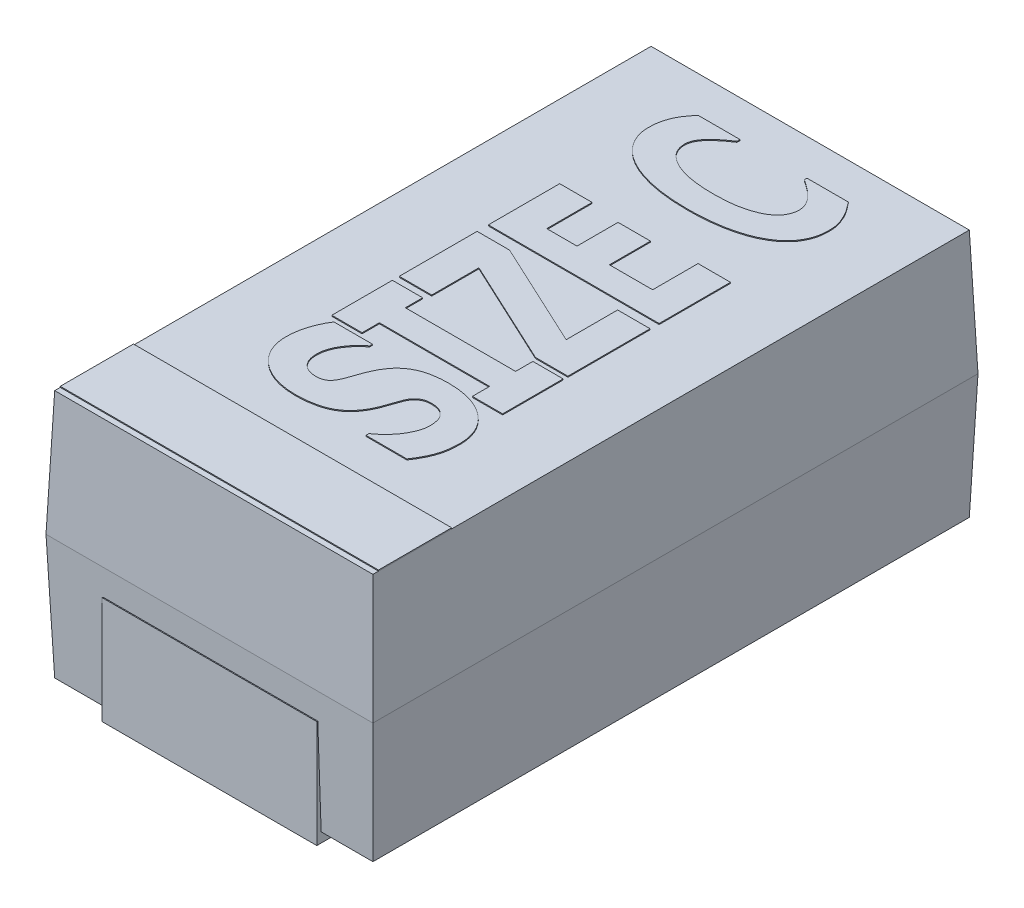
from build123d import *

# Parameters (mm, degrees)
SKETCH1_W                     = 3.35
SKETCH1_H                     = 6.2
BOSS_EXTRUDE1_DEPTH           = 1.275
BOSS_EXTRUDE1_TAPER           = 2
BOSS_EXTRUDE1_OTHER_WAY_DEPTH = 1.275
BOSS_EXTRUDE1_OTHER_WAY_TAPER = 2
BOSS_EXTRUDE2_DEPTH           = 0.1
BOSS_EXTRUDE2_DEPTH_BACK      = 1
SKETCH2_W                     = 2.2
SKETCH2_H                     = 1.35
SKETCH3_W                     = 3.260952038
SKETCH3_H                     = 0.75
EXTRUDE_THIN1_DEPTH           = 0.01
BOSS_EXTRUDE3_DEPTH           = 0.01


with BuildPart() as part:
    # Sketch1 → Boss-Extrude1 (new body)
    with BuildSketch(Plane(origin=(0, 0, 0), x_dir=(1, 0, 0), z_dir=(0, 1, 0))):
        Rectangle(SKETCH1_W, SKETCH1_H)
    extrude(amount=BOSS_EXTRUDE1_DEPTH, taper=BOSS_EXTRUDE1_TAPER)

    # Sketch1 → Boss-Extrude1 other way (add)
    with BuildSketch(Plane(origin=(0, 0, 0), x_dir=(1, 0, 0), z_dir=(0, 1, 0))):
        Rectangle(SKETCH1_W, SKETCH1_H)
    extrude(amount=-BOSS_EXTRUDE1_OTHER_WAY_DEPTH, taper=BOSS_EXTRUDE1_OTHER_WAY_TAPER)

    # Sketch2 → Boss-Extrude2 (add, two sides: drawn at the far end of the back side and taken through both)
    with BuildSketch(Plane.XZ.offset(1.275).offset(-BOSS_EXTRUDE2_DEPTH_BACK)):
        with Locations((0, 2.425)):
            Rectangle(SKETCH2_W, SKETCH2_H)
        with Locations((0, -2.425)):
            Rectangle(SKETCH2_W, SKETCH2_H)
    extrude(amount=BOSS_EXTRUDE2_DEPTH + BOSS_EXTRUDE2_DEPTH_BACK)

    # Sketch3 → Extrude-Thin1 (add)
    with BuildSketch(Plane(origin=(0, 1.275, 0), x_dir=(1, 0, 0), z_dir=(0, 1, 0))):
        with Locations((0, -2.623518775)):
            Rectangle(SKETCH3_W, SKETCH3_H)
    extrude(amount=EXTRUDE_THIN1_DEPTH)

    # Sketch4 → Boss-Extrude3 (add)
    with BuildSketch(Plane(origin=(0, 1.275, 0), x_dir=(1, 0, 0), z_dir=(0, 1, 0))):
        with BuildLine():
            add(Edge.make_bspline(
                [(0.334985513, -0.981015049), (0.356341192, -0.981437983), (0.398097454, -0.982264935), (0.459237763, -0.988016523), (0.517165286, -0.998514239), (0.572033428, -1.01266484), (0.624066299, -1.030586602), (0.672788399, -1.05312449), (0.718570647, -1.079641578), (0.76097127, -1.109898193), (0.799383719, -1.143643089), (0.832989635, -1.18065605), (0.861477479, -1.220598346), (0.885038197, -1.263473432), (0.902553009, -1.309592662), (0.915303843, -1.358322053), (0.923673634, -1.409921281), (0.924405226, -1.445363778), (0.924779816, -1.463511093)],
                knots=[0, 0, 0, 0, 1.195998746, 2.338508519, 3.434845331, 4.489568701, 5.509272365, 6.51248567, 7.491071706, 8.468291537, 9.425046025, 10.34910268, 11.26172539, 12.166745172, 13.081104647, 14.016767885, 14.984542854, 16, 16, 16, 16], degree=3))
            add(Edge.make_bspline(
                [(0.924779816, -1.463511093), (0.924305503, -1.484296469), (0.923385708, -1.524603758), (0.916550602, -1.583175424), (0.904514763, -1.637548314), (0.88761019, -1.688066754), (0.866722568, -1.735229484), (0.843896733, -1.780840346), (0.818284075, -1.824850775), (0.799295361, -1.853001712), (0.789791683, -1.867090998)],
                knots=[0, 0, 0, 0, 1.151801495, 2.233589449, 3.262100035, 4.232650712, 5.180547787, 6.118472198, 7.058312609, 8, 8, 8, 8], degree=3))
            Line((0.789791683, -1.867090998), (0.370982348, -1.867090998))
            Line((0.370982348, -1.867090998), (0.370982348, -1.837324384))
            add(Edge.make_bspline(
                [(0.370982348, -1.837324384), (0.389754163, -1.823278803), (0.426379187, -1.795874966), (0.474768814, -1.749479872), (0.516948622, -1.701148781), (0.551629713, -1.650483364), (0.579486508, -1.599249741), (0.599326457, -1.548321422), (0.612498894, -1.49844335), (0.61394651, -1.465202193), (0.614653234, -1.44897391)],
                knots=[0, 0, 0, 0, 1.184220586, 2.310490913, 3.381523037, 4.421764376, 5.408141254, 6.32227693, 7.180938069, 8, 8, 8, 8], degree=3))
            add(Edge.make_bspline(
                [(0.614653234, -1.44897391), (0.614125261, -1.439376479), (0.612922434, -1.41751163), (0.606976523, -1.383467124), (0.598646019, -1.34807723), (0.586408894, -1.327625202), (0.580733139, -1.318139258)],
                knots=[0, 0, 0, 0, 0.842610706, 1.919634185, 3.035096411, 4, 4, 4, 4], degree=3))
            add(Edge.make_bspline(
                [(0.580733139, -1.318139258), (0.572215816, -1.308311389), (0.55500165, -1.288448508), (0.527353645, -1.268878698), (0.500994402, -1.257381773), (0.476812346, -1.250716645), (0.448239825, -1.247755748), (0.427865605, -1.247156774), (0.417016763, -1.246837834)],
                knots=[0, 0, 0, 0, 1.254849191, 2.536147055, 3.230490899, 4.028879942, 4.950420152, 6, 6, 6, 6], degree=3))
            add(Edge.make_bspline(
                [(0.417016763, -1.246837834), (0.407524542, -1.247110937), (0.389171507, -1.247638977), (0.36266994, -1.253432387), (0.338173194, -1.262726788), (0.315985414, -1.276059585), (0.295778396, -1.29261467), (0.278217003, -1.312768519), (0.263003991, -1.336482193), (0.255255016, -1.3540143), (0.251223645, -1.363135302)],
                knots=[0, 0, 0, 0, 1.050957811, 2.032007846, 2.991808834, 3.943991893, 4.88910184, 5.877133343, 6.89558797, 8, 8, 8, 8], degree=3))
            add(Edge.make_bspline(
                [(0.251223645, -1.363135302), (0.243437054, -1.383614039), (0.227517982, -1.425481205), (0.206697569, -1.489911404), (0.18482008, -1.554753228), (0.163939585, -1.595144709), (0.153616842, -1.61511315)],
                knots=[0, 0, 0, 0, 0.971496617, 1.986148334, 3.00440698, 4, 4, 4, 4], degree=3))
            add(Edge.make_bspline(
                [(0.153616842, -1.61511315), (0.147429375, -1.626053844), (0.135316658, -1.647471584), (0.114650781, -1.677615611), (0.092166315, -1.705037447), (0.068489054, -1.730742964), (0.043021628, -1.753819961), (0.015684951, -1.774363031), (-0.013021806, -1.792854459), (-0.04362911, -1.808616592), (-0.075692735, -1.822737039), (-0.109870841, -1.834213564), (-0.145642031, -1.844920871), (-0.183611064, -1.852442053), (-0.223136397, -1.859347851), (-0.264659468, -1.863574757), (-0.30807076, -1.866468475), (-0.33764248, -1.866880395), (-0.352761718, -1.867090998)],
                knots=[0, 0, 0, 0, 1.00858435, 1.974426459, 2.929014615, 3.852922288, 4.777386756, 5.683106967, 6.595102396, 7.514683481, 8.443728771, 9.404362227, 10.406762678, 11.438424746, 12.508726001, 13.62653202, 14.786508553, 16, 16, 16, 16], degree=3))
            add(Edge.make_bspline(
                [(-0.352761718, -1.867090998), (-0.372970252, -1.866717333), (-0.412563805, -1.865985231), (-0.470392313, -1.859523672), (-0.525419875, -1.849673085), (-0.577550011, -1.835445531), (-0.626947712, -1.817112534), (-0.673439062, -1.794456151), (-0.717310955, -1.768205153), (-0.757752912, -1.737752318), (-0.794157754, -1.704018618), (-0.826446902, -1.668002951), (-0.853171655, -1.629103034), (-0.875591279, -1.588294829), (-0.892506402, -1.544813095), (-0.905160649, -1.499298448), (-0.912459433, -1.451286428), (-0.91336678, -1.41853913), (-0.913827779, -1.401901125)],
                knots=[0, 0, 0, 0, 1.187767207, 2.327132032, 3.416789765, 4.471602347, 5.499729975, 6.509979684, 7.508109853, 8.501179379, 9.480414611, 10.422286181, 11.338653532, 12.249228205, 13.153642482, 14.075192113, 15.022057799, 16, 16, 16, 16], degree=3))
            add(Edge.make_bspline(
                [(-0.913827779, -1.401901125), (-0.913436761, -1.384805516), (-0.912654789, -1.350617026), (-0.906049545, -1.299612503), (-0.89613404, -1.248894608), (-0.882006094, -1.199035166), (-0.864222759, -1.151198217), (-0.84525419, -1.105696137), (-0.823269315, -1.063968362), (-0.806923072, -1.038027608), (-0.798914804, -1.025318846)],
                knots=[0, 0, 0, 0, 1.027792586, 2.0554212, 3.088284028, 4.133864554, 5.167752418, 6.156312557, 7.09675003, 8, 8, 8, 8], degree=3))
            Line((-0.798914804, -1.025318846), (-0.404334108, -1.025318846))
            Line((-0.404334108, -1.025318846), (-0.404334108, -1.054393213))
            add(Edge.make_bspline(
                [(-0.404334108, -1.054393213), (-0.418196672, -1.06541933), (-0.445798999, -1.087373889), (-0.482826056, -1.125367813), (-0.516999317, -1.166270715), (-0.547213591, -1.210374308), (-0.572139779, -1.25668626), (-0.590457835, -1.304160775), (-0.601736137, -1.352338121), (-0.603049419, -1.384767942), (-0.603701196, -1.400862754)],
                knots=[0, 0, 0, 0, 1.027414864, 2.045728357, 3.073143221, 4.119102359, 5.143915698, 6.119177623, 7.066554142, 8, 8, 8, 8], degree=3))
            add(Edge.make_bspline(
                [(-0.603701196, -1.400862754), (-0.603263203, -1.412190709), (-0.602380723, -1.435014587), (-0.596358399, -1.4691679), (-0.583805577, -1.503040629), (-0.570232459, -1.523289807), (-0.563204756, -1.533774147)],
                knots=[0, 0, 0, 0, 0.961421331, 1.937098452, 2.931899252, 4, 4, 4, 4], degree=3))
            add(Edge.make_bspline(
                [(-0.563204756, -1.533774147), (-0.559663186, -1.538414465), (-0.552442847, -1.547874861), (-0.53828818, -1.559866317), (-0.522566797, -1.571889066), (-0.50383051, -1.582033967), (-0.483343499, -1.590613254), (-0.461199562, -1.597054664), (-0.43765781, -1.600300204), (-0.421533004, -1.600941901), (-0.413333317, -1.601268213)],
                knots=[0, 0, 0, 0, 0.819975247, 1.671715388, 2.601459628, 3.605522786, 4.662024498, 5.7269943, 6.844145081, 8, 8, 8, 8], degree=3))
            add(Edge.make_bspline(
                [(-0.413333317, -1.601268213), (-0.402227882, -1.600897066), (-0.381340632, -1.600199007), (-0.351938722, -1.594331747), (-0.326519998, -1.584410082), (-0.304531044, -1.569479778), (-0.285691452, -1.548470584), (-0.268125278, -1.521303556), (-0.251275947, -1.487245122), (-0.241859219, -1.461655563), (-0.236810374, -1.447935539)],
                knots=[0, 0, 0, 0, 1.043233146, 1.962126884, 2.803991179, 3.592164352, 4.43633102, 5.438031958, 6.626382715, 8, 8, 8, 8], degree=3))
            add(Edge.make_bspline(
                [(-0.236810374, -1.447935539), (-0.230233311, -1.428783282), (-0.217339253, -1.39123608), (-0.197902541, -1.334602106), (-0.174935401, -1.277010812), (-0.15536071, -1.239290287), (-0.145087668, -1.219494084)],
                knots=[0, 0, 0, 0, 0.98573715, 1.932496563, 2.914948314, 4, 4, 4, 4], degree=3))
            add(Edge.make_bspline(
                [(-0.145087668, -1.219494084), (-0.133525155, -1.200081671), (-0.110894668, -1.162087131), (-0.068064745, -1.112300539), (-0.018872329, -1.071119276), (0.026607086, -1.042912965), (0.066463264, -1.025185907), (0.098335062, -1.012900893), (0.132754433, -1.003488977), (0.168938486, -0.994939286), (0.207515861, -0.98909135), (0.248095191, -0.98384574), (0.290893103, -0.98182413), (0.320102051, -0.981288156), (0.334985513, -0.981015049)],
                knots=[0, 0, 0, 0, 1.433797049, 2.806269332, 4.148570223, 5.497680662, 6.189959962, 6.918441456, 7.665643297, 8.45526609, 9.279653554, 10.143516617, 11.054026258, 12, 12, 12, 12], degree=3))
        make_face()
        Polygon((0.880476019, -0.356331504), (0.880476019, -0.976584669), (0.570349437, -0.976584669), (0.570349437, -0.799369479), (-0.559397399, -0.799369479), (-0.559397399, -0.976584669), (-0.869523981, -0.976584669), (-0.869523981, -0.356331504), (-0.559397399, -0.356331504), (-0.559397399, -0.533546694), (0.570349437, -0.533546694), (0.570349437, -0.356331504), align=None)
        Polygon((0.880476019, 0.534174825), (0.880476019, -0.307597327), (0.548197538, -0.307597327), (-0.5372455, 0.198088986), (-0.5372455, -0.285445429), (-0.869523981, -0.285445429), (-0.869523981, 0.512022926), (-0.5372455, 0.512022926), (0.548197538, 0.006682736), (0.548197538, 0.534174825), align=None)
        Polygon((0.880476019, 1.358225458), (0.880476019, 0.627212799), (-0.869523981, 0.627212799), (-0.869523981, 1.358225458), (-0.5372455, 1.358225458), (-0.5372455, 0.893035584), (-0.227118918, 0.893035584), (-0.227118918, 1.31392166), (0.105159563, 1.31392166), (0.105159563, 0.893035584), (0.548197538, 0.893035584), (0.548197538, 1.358225458), align=None)
        with BuildLine():
            add(Edge.make_bspline(
                [(0.924779816, 2.311310901), (0.924014317, 2.292569281), (0.922503606, 2.255582756), (0.911437205, 2.201124718), (0.893008963, 2.148941932), (0.867069599, 2.099240133), (0.834560084, 2.05209659), (0.793847116, 2.009025836), (0.746913272, 1.968500058), (0.711190889, 1.9457167), (0.692877126, 1.934036375)],
                knots=[0, 0, 0, 0, 0.968697149, 1.911720619, 2.860819861, 3.821399808, 4.80279981, 5.811738422, 6.87814584, 8, 8, 8, 8], degree=3))
            add(Edge.make_bspline(
                [(0.692877126, 1.934036375), (0.672664643, 1.922653676), (0.630942925, 1.899158008), (0.561940671, 1.871022807), (0.486427981, 1.845578522), (0.403662901, 1.824757467), (0.314089685, 1.808097254), (0.217767777, 1.796727342), (0.114739368, 1.78921454), (0.043794607, 1.788394967), (0.007206636, 1.787972293)],
                knots=[0, 0, 0, 0, 0.784496091, 1.61932232, 2.517127922, 3.480400573, 4.505240943, 5.598986449, 6.761737816, 8, 8, 8, 8], degree=3))
            add(Edge.make_bspline(
                [(0.007206636, 1.787972293), (-0.027068607, 1.78848471), (-0.09406786, 1.789486352), (-0.192069003, 1.795911159), (-0.285180838, 1.807405299), (-0.373190321, 1.82304268), (-0.455763847, 1.843400121), (-0.532254327, 1.868035584), (-0.603191441, 1.895816986), (-0.64659157, 1.919189282), (-0.667734029, 1.930575141)],
                knots=[0, 0, 0, 0, 1.180016223, 2.306627155, 3.379166965, 4.408378961, 5.382333042, 6.304337012, 7.173954456, 8, 8, 8, 8], degree=3))
            add(Edge.make_bspline(
                [(-0.667734029, 1.930575141), (-0.686490363, 1.941909174), (-0.723170027, 1.964073874), (-0.772113856, 2.003997764), (-0.814882392, 2.047452842), (-0.850648764, 2.094852507), (-0.87892063, 2.145624634), (-0.899223455, 2.198978781), (-0.911342105, 2.254813646), (-0.912992801, 2.292792289), (-0.913827779, 2.312003147)],
                knots=[0, 0, 0, 0, 1.102578722, 2.156189782, 3.171148123, 4.167116028, 5.137307042, 6.088092979, 7.032893917, 8, 8, 8, 8], degree=3))
            add(Edge.make_bspline(
                [(-0.913827779, 2.312003147), (-0.913319565, 2.332584378), (-0.912351473, 2.371789355), (-0.902634639, 2.427616331), (-0.887950529, 2.47801426), (-0.87509939, 2.509276134), (-0.868831734, 2.524522926)],
                knots=[0, 0, 0, 0, 1.12747265, 2.147711277, 3.096616518, 4, 4, 4, 4], degree=3))
            add(Edge.make_bspline(
                [(-0.868831734, 2.524522926), (-0.861043117, 2.539458765), (-0.845939925, 2.568421393), (-0.819264733, 2.607775996), (-0.792529741, 2.642306922), (-0.774954768, 2.663925426), (-0.766725326, 2.674048242)],
                knots=[0, 0, 0, 0, 1.112864791, 2.157996561, 3.13748602, 4, 4, 4, 4], degree=3))
            Line((-0.766725326, 2.674048242), (-0.337878411, 2.674048242))
            Line((-0.337878411, 2.674048242), (-0.337878411, 2.643243258))
            add(Edge.make_bspline(
                [(-0.337878411, 2.643243258), (-0.348642227, 2.636024029), (-0.372383288, 2.620101037), (-0.409518872, 2.59351196), (-0.449294343, 2.562295498), (-0.474982917, 2.538663116), (-0.488095975, 2.526599666)],
                knots=[0, 0, 0, 0, 0.816654228, 1.801242047, 2.87761612, 4, 4, 4, 4], degree=3))
            add(Edge.make_bspline(
                [(-0.488095975, 2.526599666), (-0.500569948, 2.513642537), (-0.525243272, 2.488013537), (-0.550624845, 2.451677927), (-0.566740693, 2.421260949), (-0.575163708, 2.397489176), (-0.580548313, 2.373048238), (-0.581216242, 2.356334243), (-0.581549298, 2.347999983)],
                knots=[0, 0, 0, 0, 1.56199965, 3.089611039, 3.834308143, 4.548171, 5.276060557, 6, 6, 6, 6], degree=3))
            add(Edge.make_bspline(
                [(-0.581549298, 2.347999983), (-0.581091524, 2.338631788), (-0.580179458, 2.319966673), (-0.574599551, 2.292261475), (-0.564645605, 2.265463736), (-0.551149652, 2.239186362), (-0.532818269, 2.2140087), (-0.509518979, 2.189982137), (-0.481423164, 2.166759332), (-0.460102103, 2.153025531), (-0.448984029, 2.145863907)],
                knots=[0, 0, 0, 0, 0.887360765, 1.767970361, 2.663098694, 3.586644597, 4.556954427, 5.600119308, 6.748558802, 8, 8, 8, 8], degree=3))
            add(Edge.make_bspline(
                [(-0.448984029, 2.145863907), (-0.436642809, 2.139045745), (-0.410845158, 2.124793299), (-0.367723094, 2.107326532), (-0.319149452, 2.092023196), (-0.265056332, 2.077984751), (-0.205026108, 2.067092143), (-0.139155085, 2.059168448), (-0.067266553, 2.05488715), (-0.017373435, 2.054168872), (0.00859113, 2.053795078)],
                knots=[0, 0, 0, 0, 0.716681212, 1.498125243, 2.36114665, 3.306284181, 4.33879565, 5.461992926, 6.679211633, 8, 8, 8, 8], degree=3))
            add(Edge.make_bspline(
                [(0.00859113, 2.053795078), (0.035599478, 2.054084362), (0.087362721, 2.054638794), (0.16139915, 2.059976742), (0.228652951, 2.067839541), (0.288985919, 2.079997528), (0.342866004, 2.095015544), (0.390686603, 2.111454581), (0.432723244, 2.129486035), (0.457525496, 2.144119643), (0.469281399, 2.151055758)],
                knots=[0, 0, 0, 0, 1.359882022, 2.606301651, 3.736294572, 4.767507679, 5.702091033, 6.551007291, 7.313198739, 8, 8, 8, 8], degree=3))
            add(Edge.make_bspline(
                [(0.469281399, 2.151055758), (0.479713399, 2.158103854), (0.499838352, 2.171700729), (0.52621225, 2.194847542), (0.547798823, 2.219383419), (0.564400236, 2.245082644), (0.576863258, 2.271259108), (0.586087067, 2.297310907), (0.591435666, 2.323436828), (0.592149772, 2.340824382), (0.592501335, 2.349384477)],
                knots=[0, 0, 0, 0, 1.237985835, 2.388267574, 3.442420384, 4.443836432, 5.388352114, 6.289569347, 7.157935089, 8, 8, 8, 8], degree=3))
            add(Edge.make_bspline(
                [(0.592501335, 2.349384477), (0.59214214, 2.357485345), (0.591417565, 2.373826517), (0.58627553, 2.398215327), (0.578426133, 2.422603041), (0.566728384, 2.446450645), (0.552590017, 2.469752668), (0.536304445, 2.492558636), (0.517081844, 2.513923911), (0.503057025, 2.527379439), (0.495932902, 2.534214382)],
                knots=[0, 0, 0, 0, 0.905833574, 1.827258605, 2.778312694, 3.765553799, 4.790468781, 5.82581553, 6.89558957, 8, 8, 8, 8], degree=3))
            add(Edge.make_bspline(
                [(0.495932902, 2.534214382), (0.483769325, 2.545504299), (0.459420118, 2.568104602), (0.420509673, 2.597477713), (0.383569378, 2.623347482), (0.359712169, 2.638912671), (0.348830449, 2.646012246)],
                knots=[0, 0, 0, 0, 1.075504857, 2.152959624, 3.157530285, 4, 4, 4, 4], degree=3))
            Line((0.348830449, 2.646012246), (0.348830449, 2.674048242))
            Line((0.348830449, 2.674048242), (0.772485513, 2.674048242))
            add(Edge.make_bspline(
                [(0.772485513, 2.674048242), (0.782068484, 2.661475925), (0.800744543, 2.636973989), (0.828113096, 2.600857731), (0.853536464, 2.564981011), (0.866907928, 2.539342176), (0.873553551, 2.526599666)],
                knots=[0, 0, 0, 0, 1.059270606, 2.064391122, 3.038001732, 4, 4, 4, 4], degree=3))
            add(Edge.make_bspline(
                [(0.873553551, 2.526599666), (0.88125434, 2.51058436), (0.895948073, 2.480025853), (0.909899163, 2.440213941), (0.918279049, 2.407334732), (0.922084819, 2.379021498), (0.924546197, 2.346545216), (0.92469869, 2.323546382), (0.924779816, 2.311310901)],
                knots=[0, 0, 0, 0, 1.427661494, 2.72409428, 3.383167119, 4.151771524, 5.016734319, 6, 6, 6, 6], degree=3))
        make_face()
    extrude(amount=BOSS_EXTRUDE3_DEPTH)


solid = part.part
